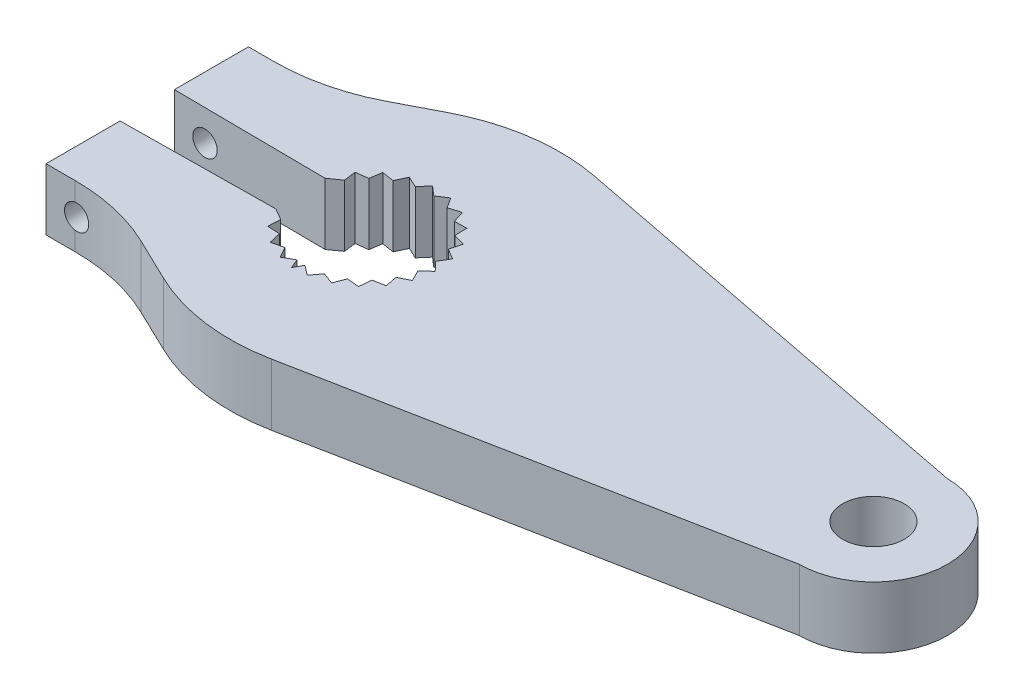
from build123d import *

# Parameters (mm, degrees)
BOSS_EXTRUDE1_DEPTH     = 6.35
CUT_EXTRUDE1_REACH      = 46.798
SKETCH2_R               = 3.175
CUT_EXTRUDE2_DEPTH      = 45.797927572
CUT_EXTRUDE2_DEPTH_BACK = 45.797927572
SKETCH3_R               = 1.27


with BuildPart() as part:
    # Sketch1 → Boss-Extrude1 (new body)
    with BuildSketch(Plane(origin=(0, 0, 0), x_dir=(1, 0, 0), z_dir=(0, 1, 0))):
        with BuildLine():
            Line((-25.172750094, -2.854782141), (-23.979365131, -3.554335257))
            Line((-23.979365131, -3.554335257), (-24.045420885, -4.814754144))
            Line((-24.045420885, -4.814754144), (-22.785001999, -4.880809899))
            Line((-22.785001999, -4.880809899), (-22.501080336, -6.110609729))
            Line((-22.501080336, -6.110609729), (-21.271280506, -5.826688067))
            Line((-21.271280506, -5.826688067), (-20.659378714, -6.930588121))
            Line((-20.659378714, -6.930588121), (-19.555478659, -6.318686329))
            Line((-19.555478659, -6.318686329), (-19.145844879, -7.284635532))
            Line((-19.145844879, -7.284635532), (-18.663004813, -6.38109418))
            Line((-18.663004813, -6.38109418), (-17.655008108, -7.140674179))
            Line((-17.655008108, -7.140674179), (-16.895428108, -6.132677474))
            Line((-16.895428108, -6.132677474), (-15.717110864, -6.584991086))
            Line((-15.717110864, -6.584991086), (-15.264797252, -5.406673842))
            Line((-15.264797252, -5.406673842), (-14.00745149, -5.516677342))
            Line((-14.00745149, -5.516677342), (-13.89744799, -4.259331581))
            Line((-13.89744799, -4.259331581), (-12.658488598, -4.018502271))
            Line((-12.658488598, -4.018502271), (-12.899317907, -2.779542878))
            Line((-12.899317907, -2.779542878), (-11.774735254, -2.206539397))
            Line((-11.774735254, -2.206539397), (-12.347738736, -1.081956744))
            Line((-12.347738736, -1.081956744), (-11.424661673, -0.221173456))
            Line((-11.424661673, -0.221173456), (-12.28544496, 0.701903607))
            Line((-12.28544496, 0.701903607), (-11.635390366, 1.783776131))
            Line((-11.635390366, 1.783776131), (-12.717262889, 2.433830725))
            Line((-12.717262889, 2.433830725), (-12.390594789, 3.652972671))
            Line((-12.390594789, 3.652972671), (-13.609736736, 3.979640771))
            Line((-13.609736736, 3.979640771), (-13.631764267, 5.241597158))
            Line((-13.631764267, 5.241597158), (-14.893720653, 5.219569627))
            Line((-14.893720653, 5.219569627), (-15.262737196, 6.426568353))
            Line((-15.262737196, 6.426568353), (-16.469735922, 6.05755181))
            Line((-16.469735922, 6.05755181), (-17.157151327, 7.116078708))
            Line((-17.157151327, 7.116078708), (-18.215678225, 6.428663303))
            Line((-18.215678225, 6.428663303), (-19.168233878, 7.256707299))
            Line((-19.168233878, 7.256707299), (-19.996277875, 6.304151646))
            Line((-19.996277875, 6.304151646), (-21.140172995, 6.837558701))
            Line((-21.140172995, 6.837558701), (-21.67358005, 5.69366358))
            Line((-21.67358005, 5.69366358), (-22.920189524, 5.891107124))
            Line((-22.920189524, 5.891107124), (-23.117633068, 4.64449765))
            Line((-23.117633068, 4.64449765), (-24.370373821, 4.490680427))
            Line((-24.370373821, 4.490680427), (-24.216556598, 3.237939674))
            Line((-24.216556598, 3.237939674), (-25.378370526, 2.412676209))
            Line((-25.378370526, 2.412676209), (-41.02702196, 2.557572596))
            Line((-41.02702196, 2.557572596), (-41.02702196, 10.177572596))
            Line((-41.02702196, 10.177572596), (-38.355583111, 10.177572596))
            ThreePointArc((-38.355583111, 10.177572596), (-33.547545085, 10.754594848), (-29.012572504, 12.452890476))
            Line((-29.012572504, 12.452890476), (-24.949455261, 14.556654192))
            ThreePointArc((-24.949455261, 14.556654192), (-18.492857296, 16.625923003), (-11.714907277, 16.455851756))
            Line((-11.714907277, 16.455851756), (33.40702196, 7.651462795))
            ThreePointArc((33.40702196, 7.651462795), (41.02702196, 0.031462795), (33.40702196, -7.588537205))
            Line((33.40702196, -7.588537205), (-12.038677684, -16.4558708))
            ThreePointArc((-12.038677684, -16.4558708), (-18.523682802, -16.66577615), (-24.744249109, -14.820808279))
            Line((-24.744249109, -14.820808279), (-29.229404705, -12.661591197))
            ThreePointArc((-29.229404705, -12.661591197), (-33.523201838, -11.159597642), (-38.043536354, -10.650427404))
            Line((-38.043536354, -10.650427404), (-41.02702196, -10.650427404))
            Line((-41.02702196, -10.650427404), (-41.02702196, -3.030427404))
            Line((-41.02702196, -3.030427404), (-25.172750094, -2.854782141))
        make_face()
    extrude(amount=BOSS_EXTRUDE1_DEPTH)

    # Sketch2 → Cut-Extrude1 (cut, up to next)
    with BuildSketch(Plane(origin=(0, 6.35, 0), x_dir=(1, 0, 0), z_dir=(0, 1, 0)), mode=Mode.PRIVATE) as cut_extrude1_sk1:
        with Locations(Location((33.40702196, 0.031462795, 0), (0, 0, 270))):
            Circle(SKETCH2_R)
    cut_extrude1_tool1 = extrude(cut_extrude1_sk1.sketch, amount=-CUT_EXTRUDE1_REACH, mode=Mode.PRIVATE) & part.part
    add(cut_extrude1_tool1.solids().sort_by_distance((33.407022, 6.35, -0.031463))[0], mode=Mode.SUBTRACT)

    # Sketch3 → Cut-Extrude2 (cut, two sides: drawn at the far end of the back side and taken through both)
    with BuildSketch(Plane.XY.offset(-CUT_EXTRUDE2_DEPTH_BACK)):
        with Locations((-37.85202196, 3.175)):
            Circle(SKETCH3_R)
    extrude(amount=CUT_EXTRUDE2_DEPTH + CUT_EXTRUDE2_DEPTH_BACK, mode=Mode.SUBTRACT)


solid = part.part
